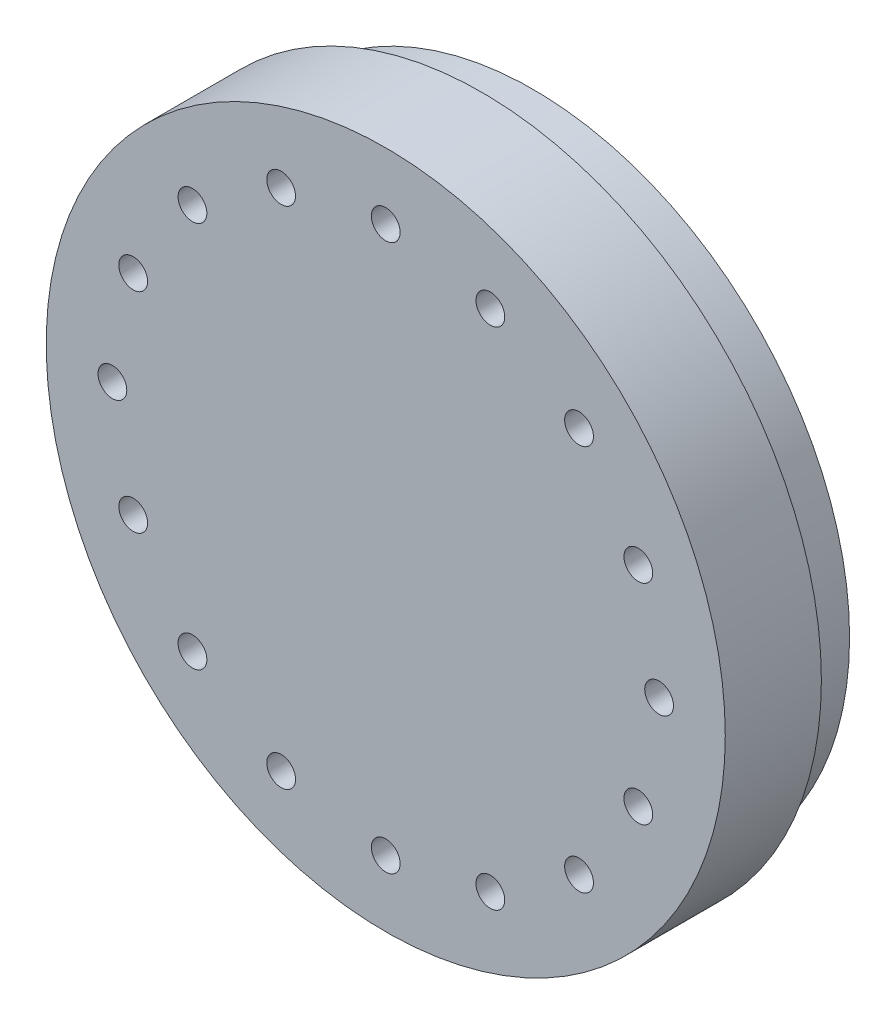
from build123d import *

# Parameters (mm, degrees)
SKETCH1_R           = 29.5
BOSS_EXTRUDE1_DEPTH = 4.175
SKETCH2_R           = 27.5
BOSS_EXTRUDE2_DEPTH = 4.45
SKETCH3_R           = 1.25
CUT_EXTRUDE1_DEPTH  = 44.638744253
CIRPATTERN1_COUNT   = 16


with BuildPart() as part:
    # Sketch1 → Boss-Extrude1 (new, symmetric)
    with BuildSketch(Plane.XY):
        Circle(SKETCH1_R)
    extrude(amount=BOSS_EXTRUDE1_DEPTH, both=True)

    # Sketch2 → Boss-Extrude2 (add)
    with BuildSketch(Plane(origin=(0, 0, -4.175), x_dir=(-1, 0, 0), z_dir=(0, 0, -1))):
        Circle(SKETCH2_R)
    extrude(amount=BOSS_EXTRUDE2_DEPTH)

    # Sketch3 → Cut-Extrude1 (cut, through all)
    with BuildSketch(Plane.XY.offset(4.175)):
        with Locations((0, 23.75)):
            Circle(SKETCH3_R)
    cut_extrude1 = extrude(amount=-CUT_EXTRUDE1_DEPTH, mode=Mode.SUBTRACT)

    # CirPattern1: Cut-Extrude1 ×16 about axis
    cirpattern1_axis = Axis((0, 0, 0), (0, 0, 1))
    for i in range(1, CIRPATTERN1_COUNT):
        add(cut_extrude1.rotate(cirpattern1_axis, i * 360 / CIRPATTERN1_COUNT), mode=Mode.SUBTRACT)


solid = part.part
